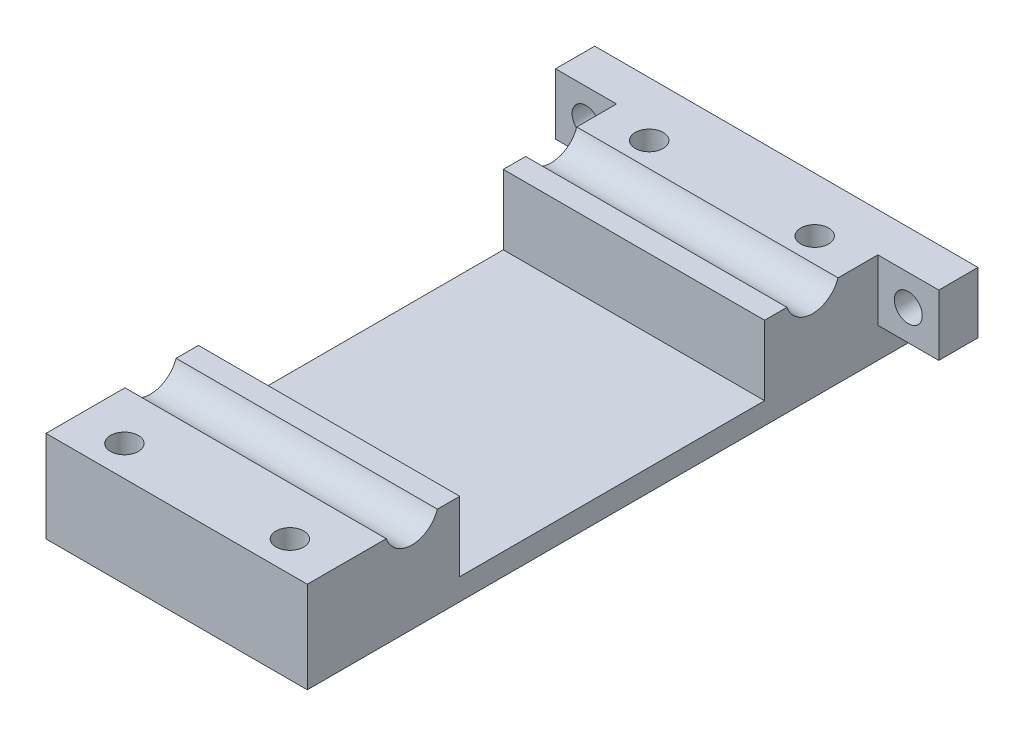
from build123d import *

# Parameters (mm, degrees)
SKETCH1_W           = 30
SKETCH1_H           = 70
BOSS_EXTRUDE1_DEPTH = 10.5
SKETCH2_W           = 30
SKETCH2_H           = 35
CUT_EXTRUDE1_DEPTH  = 8
SKETCH3_R           = 3.1
CUT_EXTRUDE2_DEPTH  = 48.2784306
SKETCH4_R           = 1.6
CUT_EXTRUDE3_DEPTH  = 40.5
SKETCH5_W           = 7
SKETCH5_H           = 7
BOSS_EXTRUDE2_DEPTH = 4.5
CUT_EXTRUDE4_REACH  = 76.123
SKETCH6_R           = 1.6


with BuildPart() as part:
    # Sketch1 → Boss-Extrude1 (new body)
    with BuildSketch(Plane(origin=(0, 0, 0), x_dir=(1, 0, 0), z_dir=(0, 1, 0))):
        Rectangle(SKETCH1_W, SKETCH1_H)
    extrude(amount=BOSS_EXTRUDE1_DEPTH)

    # Sketch2 → Cut-Extrude1 (cut)
    with BuildSketch(Plane(origin=(0, 10.5, 0), x_dir=(1, 0, 0), z_dir=(0, 1, 0))):
        Rectangle(SKETCH2_W, SKETCH2_H)
    extrude(amount=-CUT_EXTRUDE1_DEPTH, mode=Mode.SUBTRACT)

    # Sketch3 → Cut-Extrude2 (cut, through all)
    with BuildSketch(Plane(origin=(15, 0, 0), x_dir=(0, 0, -1), z_dir=(1, 0, 0))):
        with Locations((-23, 11.5)):
            Circle(SKETCH3_R)
        with Locations((23, 11.5)):
            Circle(SKETCH3_R)
    extrude(amount=-CUT_EXTRUDE2_DEPTH, mode=Mode.SUBTRACT)

    # Sketch4 → Cut-Extrude3 (cut, through all)
    with BuildSketch(Plane(origin=(0, 10.5, 0), x_dir=(1, 0, 0), z_dir=(0, 1, 0))):
        with Locations(Location((-9.5, -31.5, 0), (0, 0, 270))):
            Circle(SKETCH4_R)
        with Locations(Location((9.5, -31.5, 0), (0, 0, 270))):
            Circle(SKETCH4_R)
        with Locations(Location((-9.5, 28.75, 0), (0, 0, 270))):
            Circle(SKETCH4_R)
        with Locations(Location((9.5, 28.75, 0), (0, 0, 270))):
            Circle(SKETCH4_R)
    extrude(amount=-CUT_EXTRUDE3_DEPTH, mode=Mode.SUBTRACT)

    # Sketch5 → Boss-Extrude2 (add)
    with BuildSketch(Plane(origin=(0, 0, -35), x_dir=(-1, 0, 0), z_dir=(0, 0, -1))):
        with Locations((18.5, 7)):
            Rectangle(SKETCH5_W, SKETCH5_H)
        with Locations((-18.5, 7)):
            Rectangle(SKETCH5_W, SKETCH5_H)
    extrude(amount=-BOSS_EXTRUDE2_DEPTH)

    # Sketch6 → Cut-Extrude4 (cut, up to next)
    with BuildSketch(Plane(origin=(0, 0, -35), x_dir=(-1, 0, 0), z_dir=(0, 0, -1)), mode=Mode.PRIVATE) as cut_extrude4_sk1:
        with Locations((-18.5, 7)):
            Circle(SKETCH6_R)
    cut_extrude4_tool1 = extrude(cut_extrude4_sk1.sketch, amount=-CUT_EXTRUDE4_REACH, mode=Mode.PRIVATE) & part.part
    # Sketch6 → Cut-Extrude4 (cut, up to next)
    with BuildSketch(Plane(origin=(0, 0, -35), x_dir=(-1, 0, 0), z_dir=(0, 0, -1)), mode=Mode.PRIVATE) as cut_extrude4_sk2:
        with Locations((18.5, 7)):
            Circle(SKETCH6_R)
    cut_extrude4_tool2 = extrude(cut_extrude4_sk2.sketch, amount=-CUT_EXTRUDE4_REACH, mode=Mode.PRIVATE) & part.part
    add(cut_extrude4_tool1.solids().sort_by_distance((18.5, 7, -35))[0], mode=Mode.SUBTRACT)
    add(cut_extrude4_tool2.solids().sort_by_distance((-18.5, 7, -35))[0], mode=Mode.SUBTRACT)


solid = part.part
